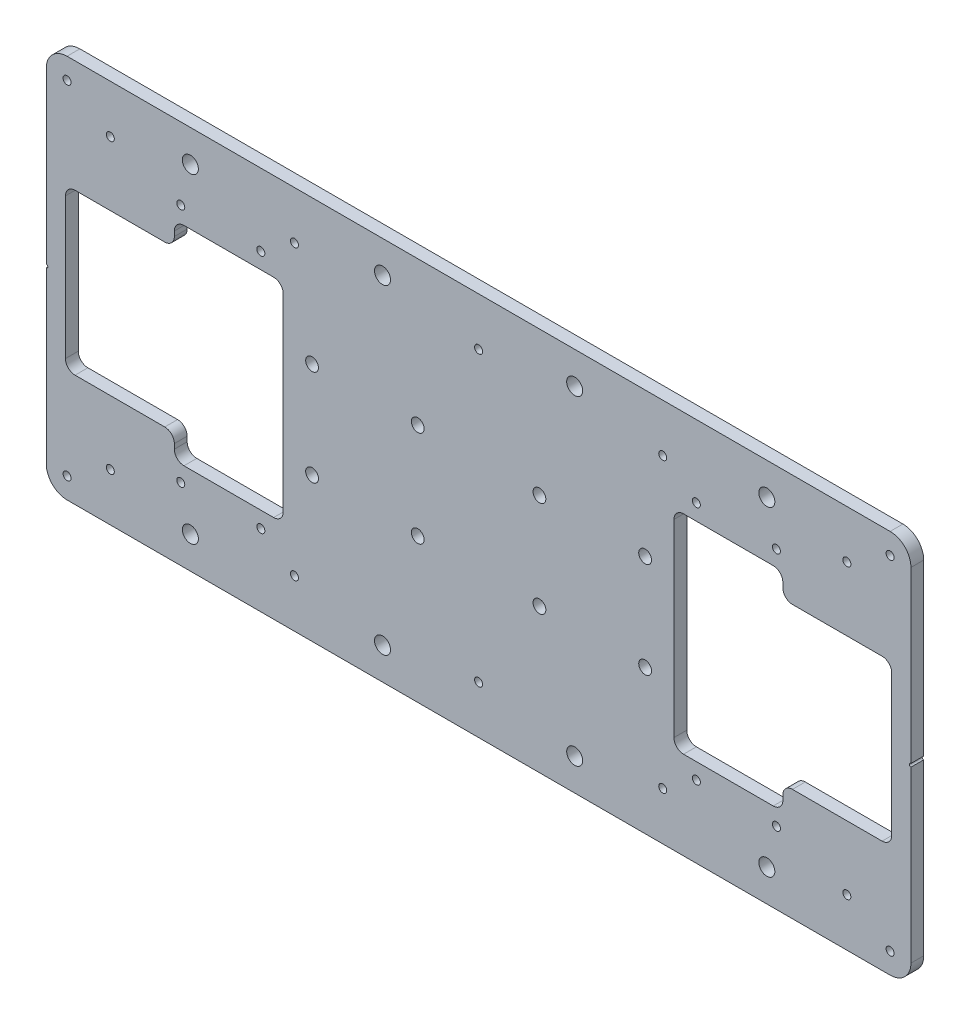
from build123d import *

# Parameters (mm, degrees)
ESQUISSE1_W             = 135
ESQUISSE1_H             = 120
BOSS_EXTRU_1_DEPTH      = 4
ENL_V_MAT_EXTRU_1_REACH = 149.787
CONG_1_R                = 3
ENL_V_MAT_EXTRU_2_REACH = 149.787
ESQUISSE3_R             = 2.5
ESQUISSE3_R_2           = 1.25
ESQUISSE3_R_3           = 0.5
ESQUISSE3_R_4           = 2
ENL_V_MAT_EXTRU_3_REACH = 149.787
ESQUISSE4_R             = 1.25
CONG_2_R                = 6.5


with BuildPart() as part:
    # Esquisse1 → Boss.-Extru.1 (new body)
    with BuildSketch(Plane.XY):
        with Locations((67.5, 0)):
            Rectangle(ESQUISSE1_W, ESQUISSE1_H)
    extrude(amount=BOSS_EXTRU_1_DEPTH)

    # Esquisse2 → Enlèv. mat.-Extru.1 (cut, up to next)
    with BuildSketch(Plane.XY.offset(4), mode=Mode.PRIVATE) as enl_v_mat_extru_1_sk1:
        Polygon((95, -25), (95, -32.5), (61, -32.5), (61, 32.5), (95, 32.5), (95, 25), (129, 25), (129, -25), align=None)
    enl_v_mat_extru_1_tool1 = extrude(enl_v_mat_extru_1_sk1.sketch, amount=-ENL_V_MAT_EXTRU_1_REACH, mode=Mode.PRIVATE) & part.part
    add(enl_v_mat_extru_1_tool1.solids().sort_by_distance((92.782609, 0, 4))[0], mode=Mode.SUBTRACT)

    # Congé1
    cong_1_edges = [part.edges().sort_by_distance(p)[0] for p in [
        (95, 32.5, 2),
        (95, 25, 2),
        (129, 25, 2),
        (129, -25, 2),
        (95, -25, 2),
        (95, -32.5, 2),
        (61, -32.5, 2),
        (61, 32.5, 2),
    ]]
    fillet(cong_1_edges, radius=CONG_1_R)

    # Esquisse3 → Enlèv. mat.-Extru.2 (cut, up to next)
    with BuildSketch(Plane.XY.offset(4), mode=Mode.PRIVATE) as enl_v_mat_extru_2_sk1:
        with Locations((30, 50)):
            Circle(ESQUISSE3_R)
    enl_v_mat_extru_2_tool1 = extrude(enl_v_mat_extru_2_sk1.sketch, amount=-ENL_V_MAT_EXTRU_2_REACH, mode=Mode.PRIVATE) & part.part
    # Esquisse3 → Enlèv. mat.-Extru.2 (cut, up to next)
    with BuildSketch(Plane.XY.offset(4), mode=Mode.PRIVATE) as enl_v_mat_extru_2_sk2:
        with Locations((90, 50)):
            Circle(ESQUISSE3_R)
    enl_v_mat_extru_2_tool2 = extrude(enl_v_mat_extru_2_sk2.sketch, amount=-ENL_V_MAT_EXTRU_2_REACH, mode=Mode.PRIVATE) & part.part
    # Esquisse3 → Enlèv. mat.-Extru.2 (cut, up to next)
    with BuildSketch(Plane.XY.offset(4), mode=Mode.PRIVATE) as enl_v_mat_extru_2_sk3:
        with Locations((90, -50)):
            Circle(ESQUISSE3_R)
    enl_v_mat_extru_2_tool3 = extrude(enl_v_mat_extru_2_sk3.sketch, amount=-ENL_V_MAT_EXTRU_2_REACH, mode=Mode.PRIVATE) & part.part
    # Esquisse3 → Enlèv. mat.-Extru.2 (cut, up to next)
    with BuildSketch(Plane.XY.offset(4), mode=Mode.PRIVATE) as enl_v_mat_extru_2_sk4:
        with Locations((30, -50)):
            Circle(ESQUISSE3_R)
    enl_v_mat_extru_2_tool4 = extrude(enl_v_mat_extru_2_sk4.sketch, amount=-ENL_V_MAT_EXTRU_2_REACH, mode=Mode.PRIVATE) & part.part
    # Esquisse3 → Enlèv. mat.-Extru.2 (cut, up to next)
    with BuildSketch(Plane.XY.offset(4), mode=Mode.PRIVATE) as enl_v_mat_extru_2_sk5:
        with Locations((0, 45)):
            Circle(ESQUISSE3_R_2)
    enl_v_mat_extru_2_tool5 = extrude(enl_v_mat_extru_2_sk5.sketch, amount=-ENL_V_MAT_EXTRU_2_REACH, mode=Mode.PRIVATE) & part.part
    # Esquisse3 → Enlèv. mat.-Extru.2 (cut, up to next)
    with BuildSketch(Plane.XY.offset(4), mode=Mode.PRIVATE) as enl_v_mat_extru_2_sk6:
        with Locations((115, 45)):
            Circle(ESQUISSE3_R_2)
    enl_v_mat_extru_2_tool6 = extrude(enl_v_mat_extru_2_sk6.sketch, amount=-ENL_V_MAT_EXTRU_2_REACH, mode=Mode.PRIVATE) & part.part
    # Esquisse3 → Enlèv. mat.-Extru.2 (cut, up to next)
    with BuildSketch(Plane.XY.offset(4), mode=Mode.PRIVATE) as enl_v_mat_extru_2_sk7:
        with Locations((115, -45)):
            Circle(ESQUISSE3_R_2)
    enl_v_mat_extru_2_tool7 = extrude(enl_v_mat_extru_2_sk7.sketch, amount=-ENL_V_MAT_EXTRU_2_REACH, mode=Mode.PRIVATE) & part.part
    # Esquisse3 → Enlèv. mat.-Extru.2 (cut, up to next)
    with BuildSketch(Plane.XY.offset(4), mode=Mode.PRIVATE) as enl_v_mat_extru_2_sk8:
        with Locations((0, -45)):
            Circle(ESQUISSE3_R_2)
    enl_v_mat_extru_2_tool8 = extrude(enl_v_mat_extru_2_sk8.sketch, amount=-ENL_V_MAT_EXTRU_2_REACH, mode=Mode.PRIVATE) & part.part
    # Esquisse3 → Enlèv. mat.-Extru.2 (cut, up to next)
    with BuildSketch(Plane.XY.offset(4), mode=Mode.PRIVATE) as enl_v_mat_extru_2_sk9:
        with Locations((57.5, -45)):
            Circle(ESQUISSE3_R_2)
    enl_v_mat_extru_2_tool9 = extrude(enl_v_mat_extru_2_sk9.sketch, amount=-ENL_V_MAT_EXTRU_2_REACH, mode=Mode.PRIVATE) & part.part
    # Esquisse3 → Enlèv. mat.-Extru.2 (cut, up to next)
    with BuildSketch(Plane.XY.offset(4), mode=Mode.PRIVATE) as enl_v_mat_extru_2_sk10:
        with Locations((57.5, 45)):
            Circle(ESQUISSE3_R_2)
    enl_v_mat_extru_2_tool10 = extrude(enl_v_mat_extru_2_sk10.sketch, amount=-ENL_V_MAT_EXTRU_2_REACH, mode=Mode.PRIVATE) & part.part
    # Esquisse3 → Enlèv. mat.-Extru.2 (cut, up to next)
    with BuildSketch(Plane.XY.offset(4), mode=Mode.PRIVATE) as enl_v_mat_extru_2_sk11:
        with Locations((128.5, 53.5)):
            Circle(ESQUISSE3_R_2)
    enl_v_mat_extru_2_tool11 = extrude(enl_v_mat_extru_2_sk11.sketch, amount=-ENL_V_MAT_EXTRU_2_REACH, mode=Mode.PRIVATE) & part.part
    # Esquisse3 → Enlèv. mat.-Extru.2 (cut, up to next)
    with BuildSketch(Plane.XY.offset(4), mode=Mode.PRIVATE) as enl_v_mat_extru_2_sk12:
        with Locations((128.5, -53.5)):
            Circle(ESQUISSE3_R_2)
    enl_v_mat_extru_2_tool12 = extrude(enl_v_mat_extru_2_sk12.sketch, amount=-ENL_V_MAT_EXTRU_2_REACH, mode=Mode.PRIVATE) & part.part
    # Esquisse3 → Enlèv. mat.-Extru.2 (cut, up to next)
    with BuildSketch(Plane.XY.offset(4), mode=Mode.PRIVATE) as enl_v_mat_extru_2_sk13:
        with Locations((135, 0)):
            Circle(ESQUISSE3_R_3)
    enl_v_mat_extru_2_tool13 = extrude(enl_v_mat_extru_2_sk13.sketch, amount=-ENL_V_MAT_EXTRU_2_REACH, mode=Mode.PRIVATE) & part.part
    # Esquisse3 → Enlèv. mat.-Extru.2 (cut, up to next)
    with BuildSketch(Plane.XY.offset(4), mode=Mode.PRIVATE) as enl_v_mat_extru_2_sk14:
        with Locations((52, 15)):
            Circle(ESQUISSE3_R_4)
    enl_v_mat_extru_2_tool14 = extrude(enl_v_mat_extru_2_sk14.sketch, amount=-ENL_V_MAT_EXTRU_2_REACH, mode=Mode.PRIVATE) & part.part
    # Esquisse3 → Enlèv. mat.-Extru.2 (cut, up to next)
    with BuildSketch(Plane.XY.offset(4), mode=Mode.PRIVATE) as enl_v_mat_extru_2_sk15:
        with Locations((19, 15)):
            Circle(ESQUISSE3_R_4)
    enl_v_mat_extru_2_tool15 = extrude(enl_v_mat_extru_2_sk15.sketch, amount=-ENL_V_MAT_EXTRU_2_REACH, mode=Mode.PRIVATE) & part.part
    # Esquisse3 → Enlèv. mat.-Extru.2 (cut, up to next)
    with BuildSketch(Plane.XY.offset(4), mode=Mode.PRIVATE) as enl_v_mat_extru_2_sk16:
        with Locations((19, -15)):
            Circle(ESQUISSE3_R_4)
    enl_v_mat_extru_2_tool16 = extrude(enl_v_mat_extru_2_sk16.sketch, amount=-ENL_V_MAT_EXTRU_2_REACH, mode=Mode.PRIVATE) & part.part
    # Esquisse3 → Enlèv. mat.-Extru.2 (cut, up to next)
    with BuildSketch(Plane.XY.offset(4), mode=Mode.PRIVATE) as enl_v_mat_extru_2_sk17:
        with Locations((52, -15)):
            Circle(ESQUISSE3_R_4)
    enl_v_mat_extru_2_tool17 = extrude(enl_v_mat_extru_2_sk17.sketch, amount=-ENL_V_MAT_EXTRU_2_REACH, mode=Mode.PRIVATE) & part.part
    add(enl_v_mat_extru_2_tool1.solids().sort_by_distance((30, 50, 4))[0], mode=Mode.SUBTRACT)
    add(enl_v_mat_extru_2_tool2.solids().sort_by_distance((90, 50, 4))[0], mode=Mode.SUBTRACT)
    add(enl_v_mat_extru_2_tool3.solids().sort_by_distance((90, -50, 4))[0], mode=Mode.SUBTRACT)
    add(enl_v_mat_extru_2_tool4.solids().sort_by_distance((30, -50, 4))[0], mode=Mode.SUBTRACT)
    add(enl_v_mat_extru_2_tool5.solids().sort_by_distance((0, 45, 4))[0], mode=Mode.SUBTRACT)
    add(enl_v_mat_extru_2_tool6.solids().sort_by_distance((115, 45, 4))[0], mode=Mode.SUBTRACT)
    add(enl_v_mat_extru_2_tool7.solids().sort_by_distance((115, -45, 4))[0], mode=Mode.SUBTRACT)
    add(enl_v_mat_extru_2_tool8.solids().sort_by_distance((0, -45, 4))[0], mode=Mode.SUBTRACT)
    add(enl_v_mat_extru_2_tool9.solids().sort_by_distance((57.5, -45, 4))[0], mode=Mode.SUBTRACT)
    add(enl_v_mat_extru_2_tool10.solids().sort_by_distance((57.5, 45, 4))[0], mode=Mode.SUBTRACT)
    add(enl_v_mat_extru_2_tool11.solids().sort_by_distance((128.5, 53.5, 4))[0], mode=Mode.SUBTRACT)
    add(enl_v_mat_extru_2_tool12.solids().sort_by_distance((128.5, -53.5, 4))[0], mode=Mode.SUBTRACT)
    add(enl_v_mat_extru_2_tool13.solids().sort_by_distance((135, 0, 4))[0], mode=Mode.SUBTRACT)
    add(enl_v_mat_extru_2_tool14.solids().sort_by_distance((52, 15, 4))[0], mode=Mode.SUBTRACT)
    add(enl_v_mat_extru_2_tool15.solids().sort_by_distance((19, 15, 4))[0], mode=Mode.SUBTRACT)
    add(enl_v_mat_extru_2_tool16.solids().sort_by_distance((19, -15, 4))[0], mode=Mode.SUBTRACT)
    add(enl_v_mat_extru_2_tool17.solids().sort_by_distance((52, -15, 4))[0], mode=Mode.SUBTRACT)

    # Esquisse4 → Enlèv. mat.-Extru.3 (cut, up to next)
    with BuildSketch(Plane.XY.offset(4), mode=Mode.PRIVATE) as enl_v_mat_extru_3_sk1:
        with Locations((68, 37.5)):
            Circle(ESQUISSE4_R)
    enl_v_mat_extru_3_tool1 = extrude(enl_v_mat_extru_3_sk1.sketch, amount=-ENL_V_MAT_EXTRU_3_REACH, mode=Mode.PRIVATE) & part.part
    # Esquisse4 → Enlèv. mat.-Extru.3 (cut, up to next)
    with BuildSketch(Plane.XY.offset(4), mode=Mode.PRIVATE) as enl_v_mat_extru_3_sk2:
        with Locations((93, 37.5)):
            Circle(ESQUISSE4_R)
    enl_v_mat_extru_3_tool2 = extrude(enl_v_mat_extru_3_sk2.sketch, amount=-ENL_V_MAT_EXTRU_3_REACH, mode=Mode.PRIVATE) & part.part
    # Esquisse4 → Enlèv. mat.-Extru.3 (cut, up to next)
    with BuildSketch(Plane.XY.offset(4), mode=Mode.PRIVATE) as enl_v_mat_extru_3_sk3:
        with Locations((68, -37.5)):
            Circle(ESQUISSE4_R)
    enl_v_mat_extru_3_tool3 = extrude(enl_v_mat_extru_3_sk3.sketch, amount=-ENL_V_MAT_EXTRU_3_REACH, mode=Mode.PRIVATE) & part.part
    # Esquisse4 → Enlèv. mat.-Extru.3 (cut, up to next)
    with BuildSketch(Plane.XY.offset(4), mode=Mode.PRIVATE) as enl_v_mat_extru_3_sk4:
        with Locations((93, -37.5)):
            Circle(ESQUISSE4_R)
    enl_v_mat_extru_3_tool4 = extrude(enl_v_mat_extru_3_sk4.sketch, amount=-ENL_V_MAT_EXTRU_3_REACH, mode=Mode.PRIVATE) & part.part
    add(enl_v_mat_extru_3_tool1.solids().sort_by_distance((68, 37.5, 4))[0], mode=Mode.SUBTRACT)
    add(enl_v_mat_extru_3_tool2.solids().sort_by_distance((93, 37.5, 4))[0], mode=Mode.SUBTRACT)
    add(enl_v_mat_extru_3_tool3.solids().sort_by_distance((68, -37.5, 4))[0], mode=Mode.SUBTRACT)
    add(enl_v_mat_extru_3_tool4.solids().sort_by_distance((93, -37.5, 4))[0], mode=Mode.SUBTRACT)

    # Congé2
    cong_2_edges = [part.edges().sort_by_distance(p)[0] for p in [
        (135, -60, 2),
        (135, 60, 2),
    ]]
    fillet(cong_2_edges, radius=CONG_2_R)

    # Symétrie1: part across plane


with BuildPart() as part_1:
    add(part.part)
    add(part.part.mirror(Plane(origin=(0, 60, 4), x_dir=(0, 0, 1), z_dir=(1, 0, 0))))


solid = part_1.part
